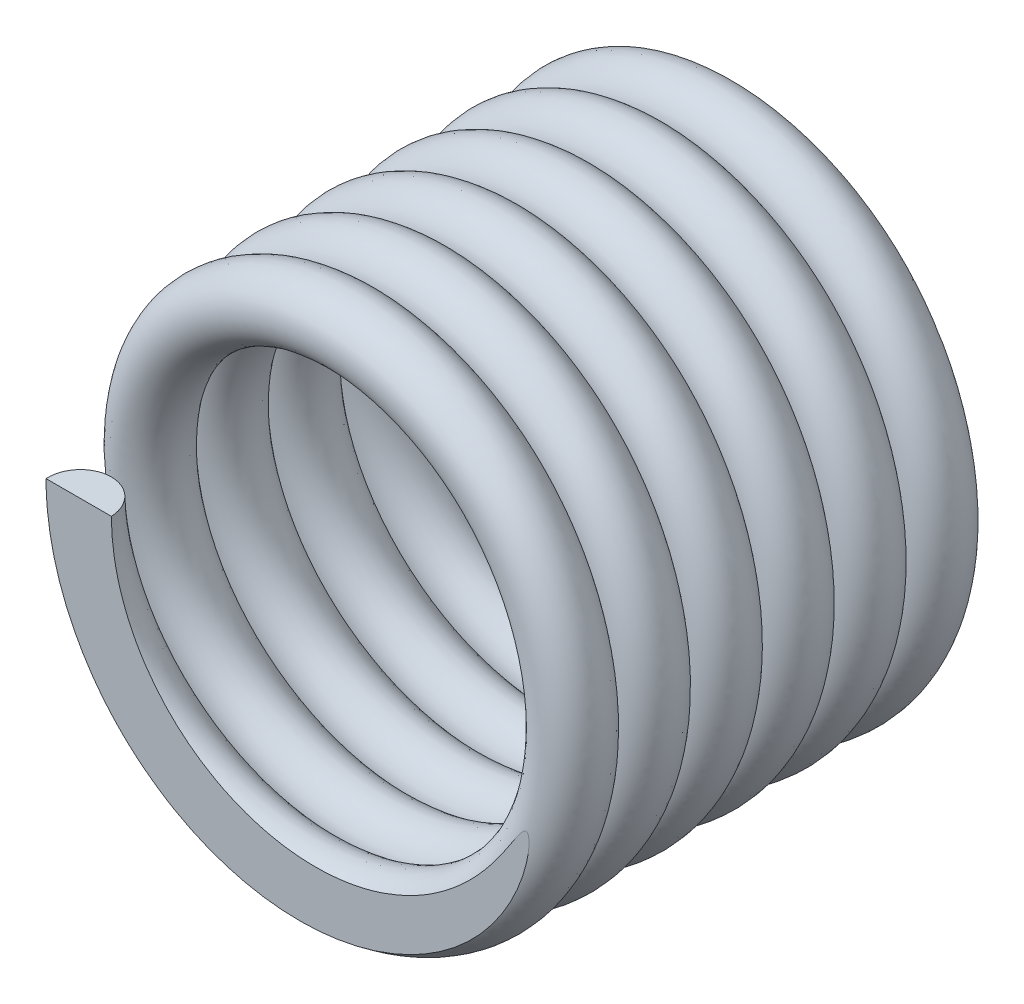
from build123d import *

# Parameters (mm, degrees)
SWEEP_1_PROFILE_R = 1


with BuildPart() as part:
    # По траектории1: sweep along a curve in space
    with BuildLine() as sweep_1_path:
        add(Edge.make_bspline(
            [(-7, 0, 0), (-7, 4.041451884, 0.183333333), (-3.5, 6.062177826, 0.366666667), (0, 8.082903769, 0.55), (3.5, 6.062177826, 0.733333333), (7, 4.041451884, 0.916666667), (7, 0, 1.1), (7, -4.041451884, 1.283333333), (3.5, -6.062177826, 1.466666667), (0, -8.082903769, 1.65), (-3.5, -6.062177826, 1.833333333), (-7, -4.041451884, 2.016666667), (-7, 0, 2.2), (-7, 4.041451884, 2.383333333), (-3.5, 6.062177826, 2.566666667), (0, 8.082903769, 2.75), (3.5, 6.062177826, 2.933333333), (7, 4.041451884, 3.116666667), (7, 0, 3.3), (7, -4.041451884, 3.483333333), (3.5, -6.062177826, 3.666666667), (0, -8.082903769, 3.85), (-3.5, -6.062177826, 4.033333333), (-7, -4.041451884, 4.216666667), (-7, 0, 4.4), (-7, 4.041451884, 4.583333333), (-3.5, 6.062177826, 4.766666667), (0, 8.082903769, 4.95), (3.5, 6.062177826, 5.133333333), (7, 4.041451884, 5.316666667), (7, 0, 5.5), (7, -4.041451884, 5.683333333), (3.5, -6.062177826, 5.866666667), (0, -8.082903769, 6.05), (-3.5, -6.062177826, 6.233333333), (-7, -4.041451884, 6.416666667), (-7, 0, 6.6), (-7, 4.041451884, 6.783333333), (-3.5, 6.062177826, 6.966666667), (0, 8.082903769, 7.15), (3.5, 6.062177826, 7.333333333), (7, 4.041451884, 7.516666667), (7, 0, 7.7), (7, -4.041451884, 7.883333333), (3.5, -6.062177826, 8.066666667), (0, -8.082903769, 8.25), (-3.5, -6.062177826, 8.433333333), (-7, -4.041451884, 8.616666667), (-7, 0, 8.8), (-7, 4.041451884, 8.983333333), (-3.5, 6.062177826, 9.166666667), (0, 8.082903769, 9.35), (3.5, 6.062177826, 9.533333333), (7, 4.041451884, 9.716666667), (7, 0, 9.9), (7, -4.041451884, 10.083333333), (3.5, -6.062177826, 10.266666667), (0, -8.082903769, 10.45), (-3.5, -6.062177826, 10.633333333), (-7, -4.041451884, 10.816666667), (-7, 0, 11), (-7, 4.041451884, 11.183333333), (-3.5, 6.062177826, 11.366666667), (0, 8.082903769, 11.55), (3.5, 6.062177826, 11.733333333), (7, 4.041451884, 11.916666667), (7, 0, 12.1), (7, -4.041451884, 12.283333333), (3.5, -6.062177826, 12.466666667), (0, -8.082903769, 12.65), (-3.5, -6.062177826, 12.833333333), (-7, -4.041451884, 13.016666667), (-7, 0, 13.2)],
            knots=[0, 0, 0, 0.027777778, 0.027777778, 0.055555556, 0.055555556, 0.083333333, 0.083333333, 0.111111111, 0.111111111, 0.138888889, 0.138888889, 0.166666667, 0.166666667, 0.194444444, 0.194444444, 0.222222222, 0.222222222, 0.25, 0.25, 0.277777778, 0.277777778, 0.305555556, 0.305555556, 0.333333333, 0.333333333, 0.361111111, 0.361111111, 0.388888889, 0.388888889, 0.416666667, 0.416666667, 0.444444444, 0.444444444, 0.472222222, 0.472222222, 0.5, 0.5, 0.527777778, 0.527777778, 0.555555556, 0.555555556, 0.583333333, 0.583333333, 0.611111111, 0.611111111, 0.638888889, 0.638888889, 0.666666667, 0.666666667, 0.694444444, 0.694444444, 0.722222222, 0.722222222, 0.75, 0.75, 0.777777778, 0.777777778, 0.805555556, 0.805555556, 0.833333333, 0.833333333, 0.861111111, 0.861111111, 0.888888889, 0.888888889, 0.916666667, 0.916666667, 0.944444444, 0.944444444, 0.972222222, 0.972222222, 1, 1, 1], degree=2, weights=[1, 0.866025404, 1, 0.866025404, 1, 0.866025404, 1, 0.866025404, 1, 0.866025404, 1, 0.866025404, 1, 0.866025404, 1, 0.866025404, 1, 0.866025404, 1, 0.866025404, 1, 0.866025404, 1, 0.866025404, 1, 0.866025404, 1, 0.866025404, 1, 0.866025404, 1, 0.866025404, 1, 0.866025404, 1, 0.866025404, 1, 0.866025404, 1, 0.866025404, 1, 0.866025404, 1, 0.866025404, 1, 0.866025404, 1, 0.866025404, 1, 0.866025404, 1, 0.866025404, 1, 0.866025404, 1, 0.866025404, 1, 0.866025404, 1, 0.866025404, 1, 0.866025404, 1, 0.866025404, 1, 0.866025404, 1, 0.866025404, 1, 0.866025404, 1, 0.866025404, 1]))
    # По траектории1 profile (on start of the path) → По траектории1 (sweep)
    with BuildSketch(Plane(origin=(-7, 0, 0), x_dir=(0, -0.045316632591765466, 0.9989726737056139), z_dir=(-6.872790375870873e-15, 0.9989726737056139, 0.045316632591765466))):
        Circle(SWEEP_1_PROFILE_R)
    sweep(path=sweep_1_path.line, is_frenet=True)

    # Surface Cut 1
    split(bisect_by=Plane.XY.offset(13.2), keep=Keep.BOTTOM)

    # Surface Cut 2
    split(bisect_by=Plane.XY, keep=Keep.TOP)


solid = part.part
